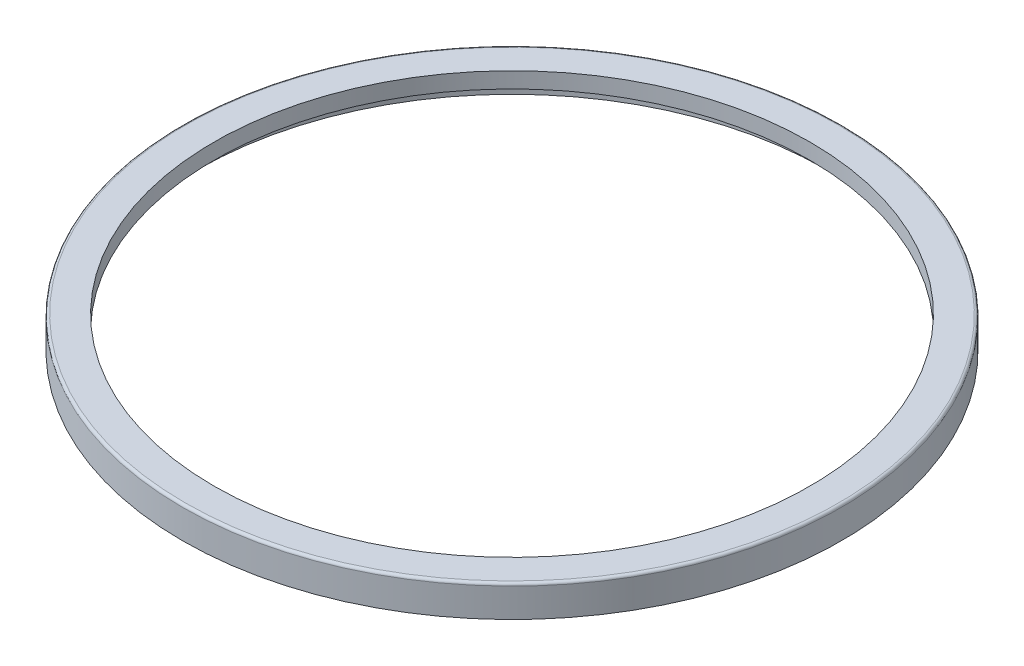
from build123d import *

# Parameters (mm, degrees)
FILLET1_R = 1.5875
FILLET2_R = 0.508


with BuildPart() as part:
    # Sketch1 → Revolve1 (revolve)
    with BuildSketch(Plane.XY, mode=Mode.PRIVATE) as revolve1_sk:
        Polygon((-57.56402, 0), (-63.66002, 0), (-63.66002, -6.096), (-60.61202, -6.096), (-60.61202, -3.048), (-57.56402, -3.048), align=None)
    revolve(revolve1_sk.sketch.rotate(Axis((0, 0, 0), (0, 1, 0)), 270), axis=Axis((0, 0, 0), (0, 1, 0)))

    # Fillet1
    fillet1_edges = [part.edges().sort_by_distance(p)[0] for p in [
        (0, -3.048, 60.61202),
    ]]
    fillet(fillet1_edges, radius=FILLET1_R)

    # Fillet2
    fillet2_edges = [part.edges().sort_by_distance(p)[0] for p in [
        (0, 0, 63.66002),
    ]]
    fillet(fillet2_edges, radius=FILLET2_R)


solid = part.part
